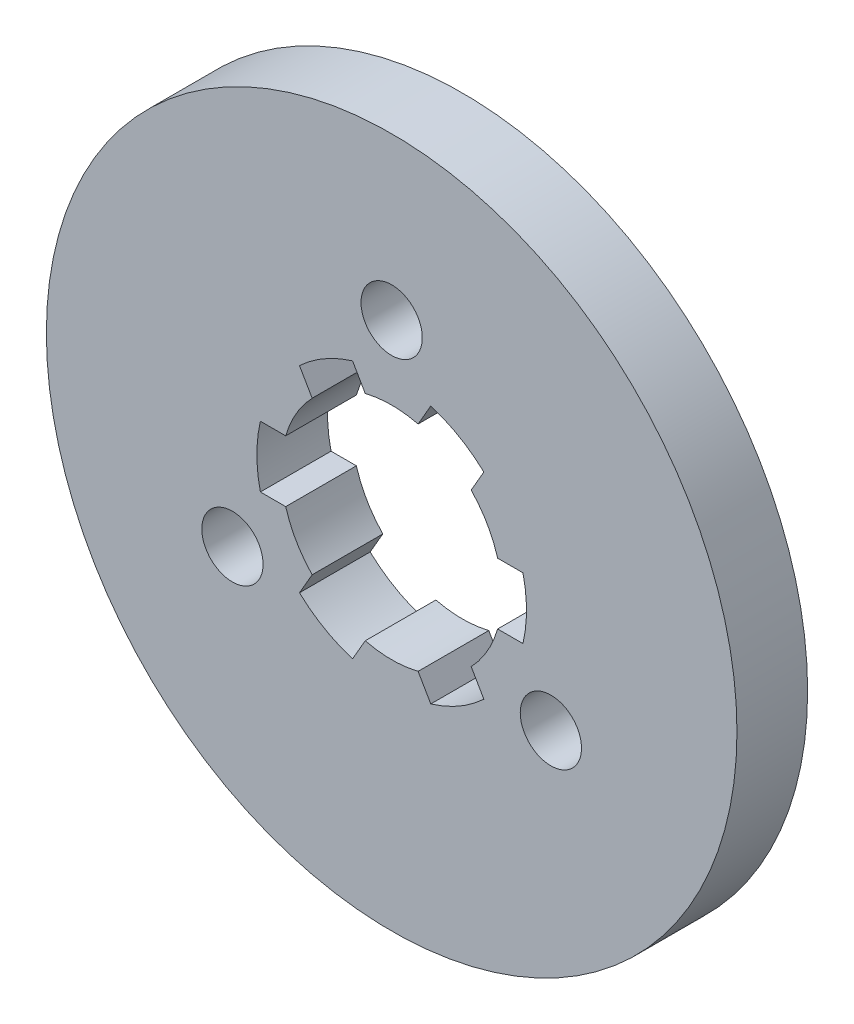
from build123d import *

# Parameters (mm, degrees)
SKETCH1_R           = 28.173882667
SKETCH1_R_2         = 2.5
BOSS_EXTRUDE1_DEPTH = 5.7658


with BuildPart() as part:
    # Sketch1 → Boss-Extrude1 (new body)
    with BuildSketch(Plane.XY):
        with Locations(Location((0, 0, 0), (0, 0, 180))):
            Circle(SKETCH1_R)
        with Locations(Location((0, 15, 0), (0, 0, 180))):
            Circle(SKETCH1_R_2, mode=Mode.SUBTRACT)
        with Locations(Location((12.990381057, -7.5, 0), (0, 0, 180))):
            Circle(SKETCH1_R_2, mode=Mode.SUBTRACT)
        with Locations(Location((-12.990381057, -7.5, 0), (0, 0, 180))):
            Circle(SKETCH1_R_2, mode=Mode.SUBTRACT)
        with BuildLine():
            Line((-10.712142643, 2.5), (-8.645808233, 2.5))
            ThreePointArc((-8.645808233, 2.5), (-7.794228634, 4.5), (-6.487967626, 6.237489566))
            Line((-6.487967626, 6.237489566), (-7.521134831, 8.026987658))
            ThreePointArc((-7.521134831, 8.026987658), (-5.5, 9.526279442), (-3.191007812, 10.526987658))
            Line((-3.191007812, 10.526987658), (-2.157840607, 8.737489566))
            ThreePointArc((-2.157840607, 8.737489566), (0, 9), (2.157840607, 8.737489566))
            Line((2.157840607, 8.737489566), (3.191007812, 10.526987658))
            ThreePointArc((3.191007812, 10.526987658), (5.5, 9.526279442), (7.521134831, 8.026987658))
            Line((7.521134831, 8.026987658), (6.487967626, 6.237489566))
            ThreePointArc((6.487967626, 6.237489566), (7.794228634, 4.5), (8.645808233, 2.5))
            Line((8.645808233, 2.5), (10.712142643, 2.5))
            ThreePointArc((10.712142643, 2.5), (11, 0), (10.712142643, -2.5))
            Line((10.712142643, -2.5), (8.645808233, -2.5))
            ThreePointArc((8.645808233, -2.5), (7.794228634, -4.5), (6.487967626, -6.237489566))
            Line((6.487967626, -6.237489566), (7.521134831, -8.026987658))
            ThreePointArc((7.521134831, -8.026987658), (5.5, -9.526279442), (3.191007812, -10.526987658))
            Line((3.191007812, -10.526987658), (2.157840607, -8.737489566))
            ThreePointArc((2.157840607, -8.737489566), (0, -9), (-2.157840607, -8.737489566))
            Line((-2.157840607, -8.737489566), (-3.191007812, -10.526987658))
            ThreePointArc((-3.191007812, -10.526987658), (-5.5, -9.526279442), (-7.521134831, -8.026987658))
            Line((-7.521134831, -8.026987658), (-6.487967626, -6.237489566))
            ThreePointArc((-6.487967626, -6.237489566), (-7.794228634, -4.5), (-8.645808233, -2.5))
            Line((-8.645808233, -2.5), (-10.712142643, -2.5))
            ThreePointArc((-10.712142643, -2.5), (-11, 0), (-10.712142643, 2.5))
        make_face(mode=Mode.SUBTRACT)
    extrude(amount=BOSS_EXTRUDE1_DEPTH)


solid = part.part
